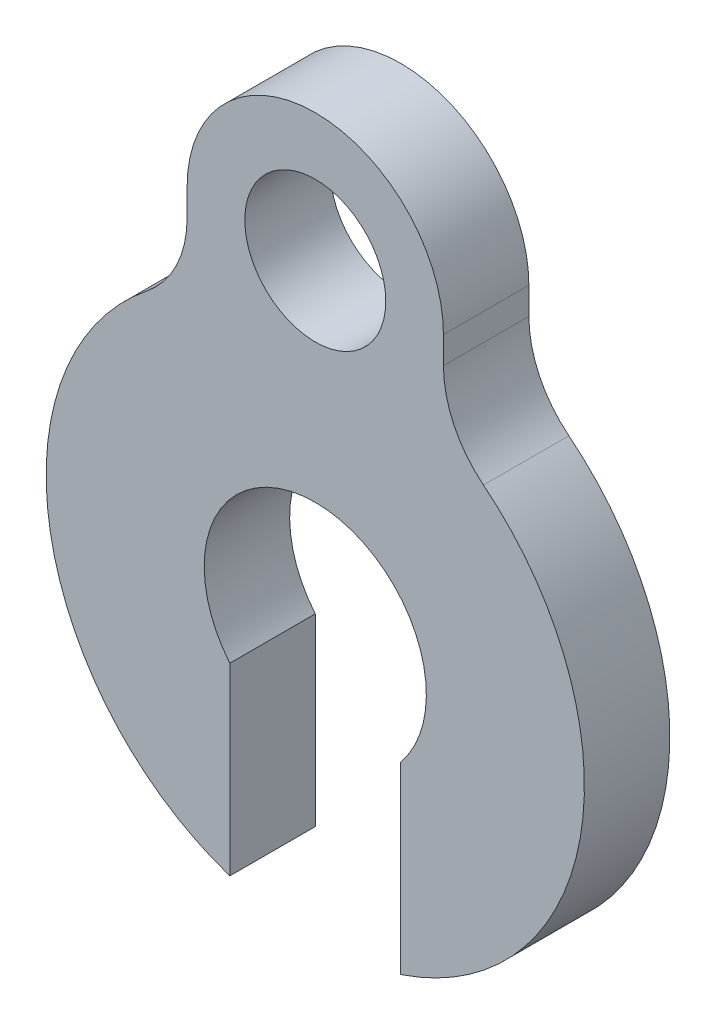
from build123d import *

# Parameters (mm, degrees)
SKETCH1_R           = 1.04775
BOSS_EXTRUDE1_DEPTH = 0.635
FILLET1_R           = 1.5875


with BuildPart() as part:
    # Sketch1 → Boss-Extrude1 (new, symmetric)
    with BuildSketch(Plane.XY):
        with BuildLine():
            Line((-1.905, 4.7625), (-1.905, 3.517808302))
            ThreePointArc((-1.905, 3.517808302), (-3.985496732, -0.346144551), (-1.27, -3.793560366))
            Line((-1.27, -3.793560366), (-1.27, -1.054941231))
            ThreePointArc((-1.27, -1.054941231), (0, 1.651), (1.27, -1.054941231))
            Line((1.27, -1.054941231), (1.27, -3.793560366))
            ThreePointArc((1.27, -3.793560366), (3.985496732, -0.346144551), (1.905, 3.517808302))
            Line((1.905, 3.517808302), (1.905, 4.7625))
            ThreePointArc((1.905, 4.7625), (0, 6.6675), (-1.905, 4.7625))
        make_face()
        with Locations((0, 4.7625)):
            Circle(SKETCH1_R, mode=Mode.SUBTRACT)
    extrude(amount=BOSS_EXTRUDE1_DEPTH, both=True)

    # Fillet1
    fillet1_edges = [part.edges().sort_by_distance(p)[0] for p in [
        (-1.905, 3.517808302, 0),
        (1.905, 3.517808302, 0),
    ]]
    fillet(fillet1_edges, radius=FILLET1_R)


solid = part.part
